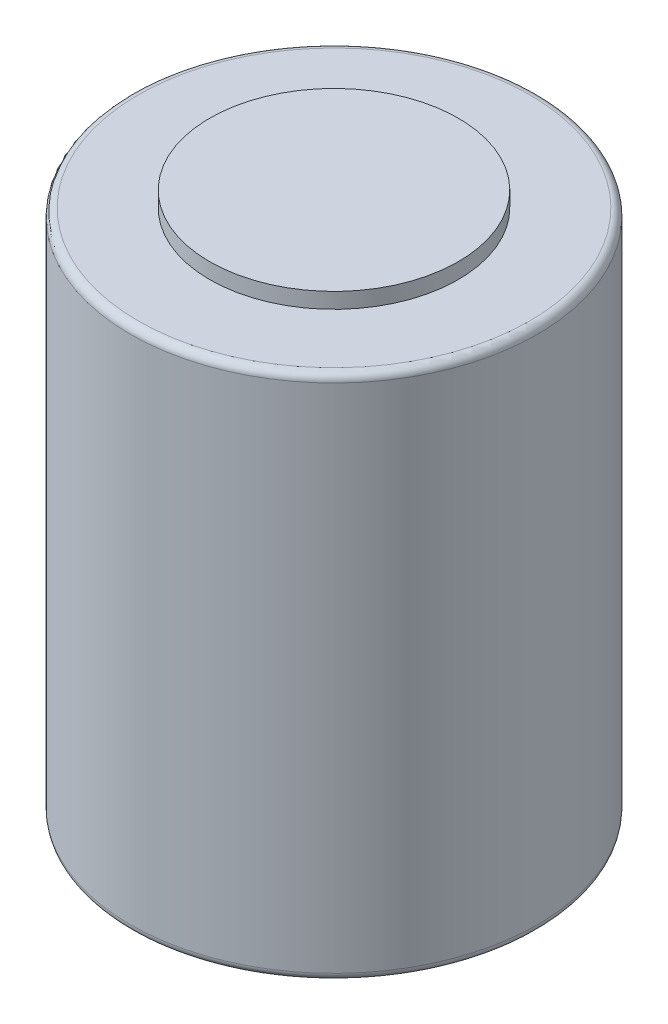
from build123d import *

# Parameters (mm, degrees)
SKETCH_1_R          = 13.1
EXTRUDE_1_DEPTH     = 35
SKETCH_2_R          = 19.270653491
SKETCH_2_R_2        = 8
CUT_EXTRUDE_1_DEPTH = 1
SKETCH_3_R          = 17.55104744
SKETCH_3_R_2        = 10.25
CUT_EXTRUDE_2_DEPTH = 0.1
FILLET_1_R          = 0.5


with BuildPart() as part:
    # Эскиз1 → Бобышка-Вытянуть1 (new body)
    with BuildSketch(Plane(origin=(0, 0, 0), x_dir=(1, 0, 0), z_dir=(0, 1, 0))):
        with Locations(Location((0, 0, 0), (0, 0, 270))):
            Circle(SKETCH_1_R)
    extrude(amount=EXTRUDE_1_DEPTH)

    # Эскиз2 → Вырез-Вытянуть1 (cut)
    with BuildSketch(Plane(origin=(0, 35, 0), x_dir=(1, 0, 0), z_dir=(0, 1, 0))):
        Circle(SKETCH_2_R)
        with Locations(Location((0, 0, 0), (0, 0, 270))):
            Circle(SKETCH_2_R_2, mode=Mode.SUBTRACT)
    extrude(amount=-CUT_EXTRUDE_1_DEPTH, mode=Mode.SUBTRACT)

    # Эскиз3 → Вырез-Вытянуть2 (cut)
    with BuildSketch(Plane.XZ):
        Circle(SKETCH_3_R)
        with Locations(Location((0, 0, 0), (0, 0, 270))):
            Circle(SKETCH_3_R_2, mode=Mode.SUBTRACT)
    extrude(amount=-CUT_EXTRUDE_2_DEPTH, mode=Mode.SUBTRACT)

    # Скругление1
    fillet_1_edges = [part.edges().sort_by_distance(p)[0] for p in [
        (0, 0.1, -13.1),
        (0, 34, -13.1),
    ]]
    fillet(fillet_1_edges, radius=FILLET_1_R)


solid = part.part
